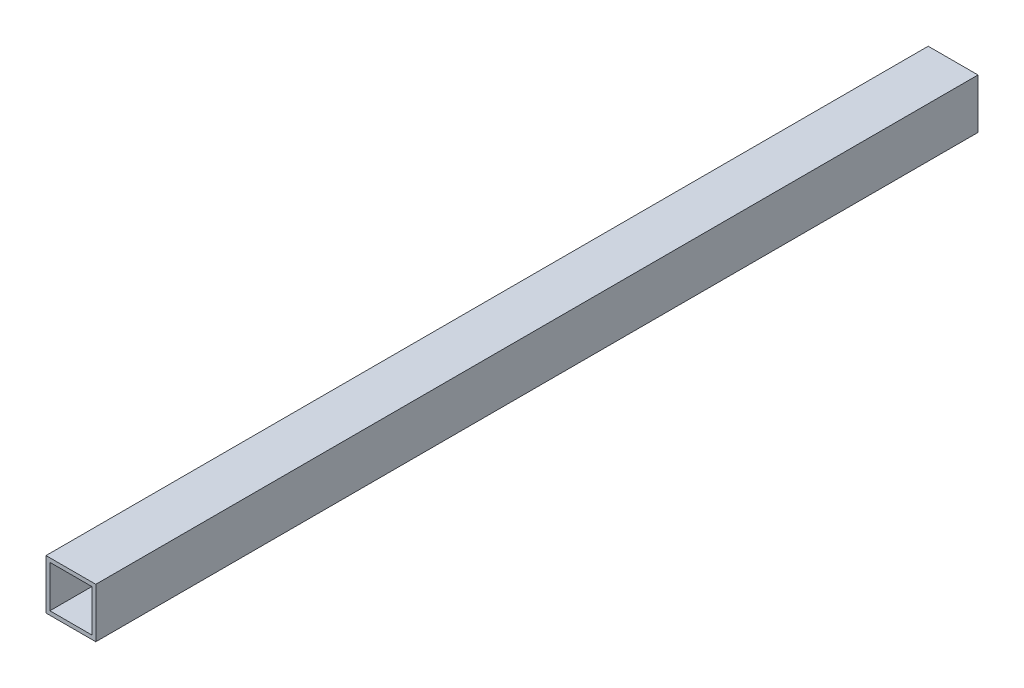
from build123d import *

# Parameters (mm, degrees)
SKETCH_1_W          = 25.4
SKETCH_1_H          = 25.4
EXTRUDE_1_DEPTH     = 450
SKETCH_1_3_W        = 21.4
SKETCH_1_3_H        = 21.4
CUT_EXTRUDE_1_DEPTH = 451.358279595


with BuildPart() as part:
    # 草圖1 → 填料-伸長1 (new body)
    with BuildSketch(Plane.XY):
        Rectangle(SKETCH_1_W, SKETCH_1_H)
    extrude(amount=EXTRUDE_1_DEPTH)

    # 草圖1<3> → 除料-伸長1 (cut, through all)
    with BuildSketch(Plane.XY):
        Rectangle(SKETCH_1_3_W, SKETCH_1_3_H)
    extrude(amount=CUT_EXTRUDE_1_DEPTH, mode=Mode.SUBTRACT)


solid = part.part
